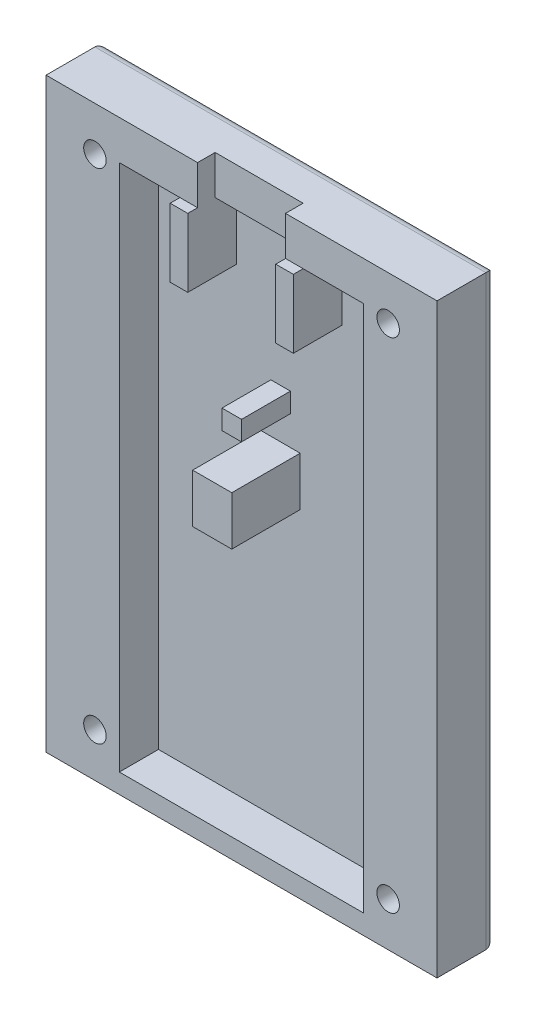
from build123d import *

# Parameters (mm, degrees)
SKETCH1_W           = 60
SKETCH1_H           = 40
BOSS_EXTRUDE1_DEPTH = 6
SKETCH3_R           = 1.15
CUT_EXTRUDE2_DEPTH  = 73.360210061
SKETCH12_W          = 25
SKETCH12_H          = 54
CUT_EXTRUDE10_DEPTH = 4
CUT_EXTRUDE11_DEPTH = 2.8
FILLET1_R           = 1
SKETCH15_W          = 9
SKETCH15_H          = 4
CUT_EXTRUDE13_DEPTH = 1.8
SKETCH16_W          = 4
SKETCH16_H          = 5
BOSS_EXTRUDE2_DEPTH = 7
SKETCH17_W          = 2
SKETCH17_H          = 2
SKETCH17_W_2        = 1.8
SKETCH17_H_2        = 7
BOSS_EXTRUDE3_DEPTH = 5


with BuildPart() as part:
    # Sketch1 → Boss-Extrude1 (new body)
    with BuildSketch(Plane(origin=(0, 0, 0), x_dir=(0, 1, 0), z_dir=(0, 0, 1))):
        with Locations((30, -20)):
            Rectangle(SKETCH1_W, SKETCH1_H)
    extrude(amount=BOSS_EXTRUDE1_DEPTH)

    # Sketch3 → Cut-Extrude2 (cut, through all)
    with BuildSketch(Plane.XY.offset(6)):
        with Locations((5, 4.5)):
            Circle(SKETCH3_R)
        with Locations((35, 4.5)):
            Circle(SKETCH3_R)
        with Locations((5, 55.5)):
            Circle(SKETCH3_R)
        with Locations((35, 55.5)):
            Circle(SKETCH3_R)
    extrude(amount=-CUT_EXTRUDE2_DEPTH, mode=Mode.SUBTRACT)

    # Sketch12 → Cut-Extrude10 (cut)
    with BuildSketch(Plane.XY.offset(6)):
        with Locations((20, 29)):
            Rectangle(SKETCH12_W, SKETCH12_H)
    extrude(amount=-CUT_EXTRUDE10_DEPTH, mode=Mode.SUBTRACT)

    # Sketch13 → Cut-Extrude11 (cut)
    with BuildSketch(Plane(origin=(0, 0, 0), x_dir=(1, 0, 0), z_dir=(0, 0, -1))):
        Polygon((7.424871131, -55.5), (6.212435565, -53.4), (3.787564435, -53.4), (2.575128869, -55.5), (3.787564435, -57.6), (6.212435565, -57.6), align=None)
        Polygon((32.575128869, -55.5), (33.787564435, -57.6), (36.212435565, -57.6), (37.424871131, -55.5), (36.212435565, -53.4), (33.787564435, -53.4), align=None)
        Polygon((7.424871131, -4.5), (6.212435565, -2.4), (3.787564435, -2.4), (2.575128869, -4.5), (3.787564435, -6.6), (6.212435565, -6.6), align=None)
        Polygon((32.575128869, -4.5), (33.787564435, -6.6), (36.212435565, -6.6), (37.424871131, -4.5), (36.212435565, -2.4), (33.787564435, -2.4), align=None)
    extrude(amount=-CUT_EXTRUDE11_DEPTH, mode=Mode.SUBTRACT)

    # Fillet1
    fillet1_edges = [part.edges().sort_by_distance(p)[0] for p in [
        (0, 30, 0),
        (20, 60, 0),
        (40, 30, 0),
        (20, 0, 0),
    ]]
    fillet(fillet1_edges, radius=FILLET1_R)

    # Sketch15 → Cut-Extrude13 (cut)
    with BuildSketch(Plane.XY.offset(6)):
        with Locations((20, 58)):
            Rectangle(SKETCH15_W, SKETCH15_H)
    extrude(amount=-CUT_EXTRUDE13_DEPTH, mode=Mode.SUBTRACT)

    # Sketch16 → Boss-Extrude2 (add)
    with BuildSketch(Plane.XY.offset(2)):
        with Locations((20, 33)):
            Rectangle(SKETCH16_W, SKETCH16_H)
    extrude(amount=BOSS_EXTRUDE2_DEPTH)

    # Sketch17 → Boss-Extrude3 (add)
    with BuildSketch(Plane.XY.offset(2)):
        with Locations((20, 39.5)):
            Rectangle(SKETCH17_W, SKETCH17_H)
        with Locations((14.6, 52.5)):
            Rectangle(SKETCH17_W_2, SKETCH17_H_2)
        with Locations((25.4, 52.5)):
            Rectangle(SKETCH17_W_2, SKETCH17_H_2)
    extrude(amount=BOSS_EXTRUDE3_DEPTH)


solid = part.part
